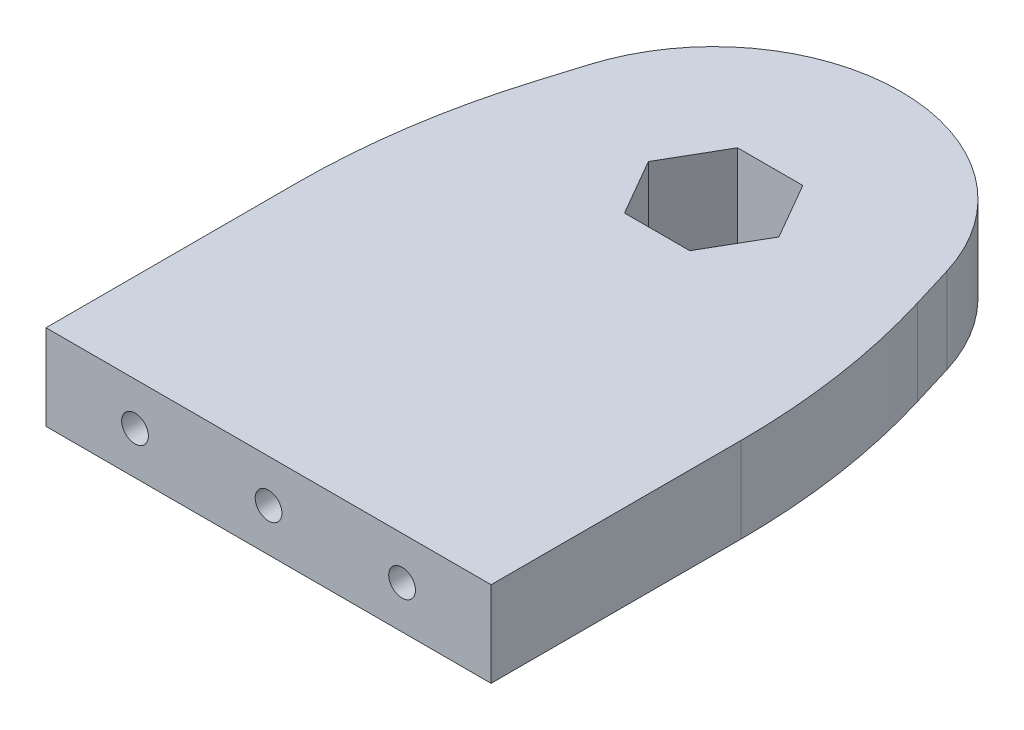
from build123d import *

# Parameters (mm, degrees)
CROQUIS1_R              = 21
CROQUIS1_W              = 50
CROQUIS1_H              = 40
SALIENTE_EXTRUIR1_DEPTH = 9.6
CROQUIS2_R              = 16
CORTAR_EXTRUIR1_DEPTH   = 58.603472118
REDONDEO1_R             = 80
CROQUIS3_R              = 1.5
CORTAR_EXTRUIR2_DEPTH   = 15
MATRIZL1_COUNT          = 2
MATRIZL1_PITCH          = 15
MATRIZL1_COL_COUNT      = 2
MATRIZL1_COL_PITCH      = 15
SKETCH1_R               = 16
BOSS_EXTRUDE1_DEPTH     = 9.6
SKETCH3_R               = 10
BOSS_EXTRUDE2_DEPTH     = 9.6
CUT_EXTRUDE2_DEPTH      = 10


with BuildPart() as part:
    # Croquis1 → Saliente-Extruir1 (new body)
    with BuildSketch(Plane(origin=(0, 0, 0), x_dir=(1, 0, 0), z_dir=(0, 1, 0))):
        with Locations((0, 30)):
            Circle(CROQUIS1_R)
        Rectangle(CROQUIS1_W, CROQUIS1_H)
        with BuildLine():
            ThreePointArc((20.088252282, 36.120630706), (0, 51), (-20.088252282, 36.120630706))
            ThreePointArc((-20.088252282, 36.120630706), (-20.89449325, 27.897584284), (-18.466185313, 20))
            Line((-18.466185313, 20), (18.466185313, 20))
            ThreePointArc((18.466185313, 20), (20.356692899, 24.841991255), (21, 30))
            ThreePointArc((21, 30), (20.770812429, 33.09408323), (20.088252282, 36.120630706))
        make_face()
        with BuildLine():
            Line((18.466185313, 20), (-18.466185313, 20))
            ThreePointArc((-18.466185313, 20), (0, 9), (18.466185313, 20))
        make_face()
        with BuildLine():
            Line((25, 20), (20.088252282, 36.120630706))
            ThreePointArc((20.088252282, 36.120630706), (20.770812429, 33.09408323), (21, 30))
            ThreePointArc((21, 30), (20.356692899, 24.841991255), (18.466185313, 20))
            Line((18.466185313, 20), (25, 20))
        make_face()
        with BuildLine():
            Line((-20.088252282, 36.120630706), (-25, 20))
            Line((-25, 20), (-18.466185313, 20))
            ThreePointArc((-18.466185313, 20), (-20.89449325, 27.897584284), (-20.088252282, 36.120630706))
        make_face()
    extrude(amount=SALIENTE_EXTRUIR1_DEPTH)

    # Croquis2 → Cortar-Extruir1 (cut, through all)
    with BuildSketch(Plane(origin=(0, 9.6, 0), x_dir=(1, 0, 0), z_dir=(0, 1, 0))):
        with Locations(Location((0, 30, 0), (0, 0, 270))):
            Circle(CROQUIS2_R)
    extrude(amount=-CORTAR_EXTRUIR1_DEPTH, mode=Mode.SUBTRACT)

    # Redondeo1
    redondeo1_edges = [part.edges().sort_by_distance(p)[0] for p in [
        (25, 4.8, -20),
        (-25, 4.8, -20),
    ]]
    fillet(redondeo1_edges, radius=REDONDEO1_R)

    # Croquis3 → Cortar-Extruir2 (cut)
    with BuildSketch(Plane.XY.offset(20)):
        with Locations((0, 4.8)):
            Circle(CROQUIS3_R)
    cortar_extruir2 = extrude(amount=-CORTAR_EXTRUIR2_DEPTH, mode=Mode.SUBTRACT)

    # MatrizL1: Cortar-Extruir2 ×2
    with Locations(*[(i * MATRIZL1_PITCH, 0, 0) for i in range(1, MATRIZL1_COUNT)]):
        add(cortar_extruir2, mode=Mode.SUBTRACT)

    # MatrizL1 col: Cortar-Extruir2 ×2
    with Locations(*[(-i * MATRIZL1_COL_PITCH, 0, 0) for i in range(1, MATRIZL1_COL_COUNT)]):
        add(cortar_extruir2, mode=Mode.SUBTRACT)

    # Sketch1 → Boss-Extrude1 (add)
    with BuildSketch(Plane(origin=(0, 9.6, 0), x_dir=(1, 0, 0), z_dir=(0, 1, 0))):
        with Locations((0, 30)):
            Circle(SKETCH1_R)
        with BuildLine():
            Line((-2.5, 36.538348415), (-2.5, 39.5))
            Line((-2.5, 39.5), (2.5, 39.5))
            Line((2.5, 39.5), (2.5, 36.538348415))
            ThreePointArc((2.5, 36.538348415), (5.766281297, 33.968626967), (7, 30))
            ThreePointArc((7, 30), (-3.968626967, 24.233718703), (-2.5, 36.538348415))
        make_face(mode=Mode.SUBTRACT)
    extrude(amount=-BOSS_EXTRUDE1_DEPTH)

    # Sketch3 → Boss-Extrude2 (add)
    with BuildSketch(Plane(origin=(0, 9.6, 0), x_dir=(1, 0, 0), z_dir=(0, 1, 0))):
        with Locations((0, 30)):
            Circle(SKETCH3_R)
    extrude(amount=-BOSS_EXTRUDE2_DEPTH)

    # Sketch2 → Cut-Extrude2 (cut)
    with BuildSketch(Plane(origin=(0, 9.6, 0), x_dir=(1, 0, 0), z_dir=(0, 1, 0))):
        Polygon((3.666174209, 36.35), (-3.666174209, 36.35), (-7.332348419, 30), (-3.666174209, 23.65), (3.666174209, 23.65), (7.332348419, 30), align=None)
    extrude(amount=-CUT_EXTRUDE2_DEPTH, mode=Mode.SUBTRACT)


solid = part.part
